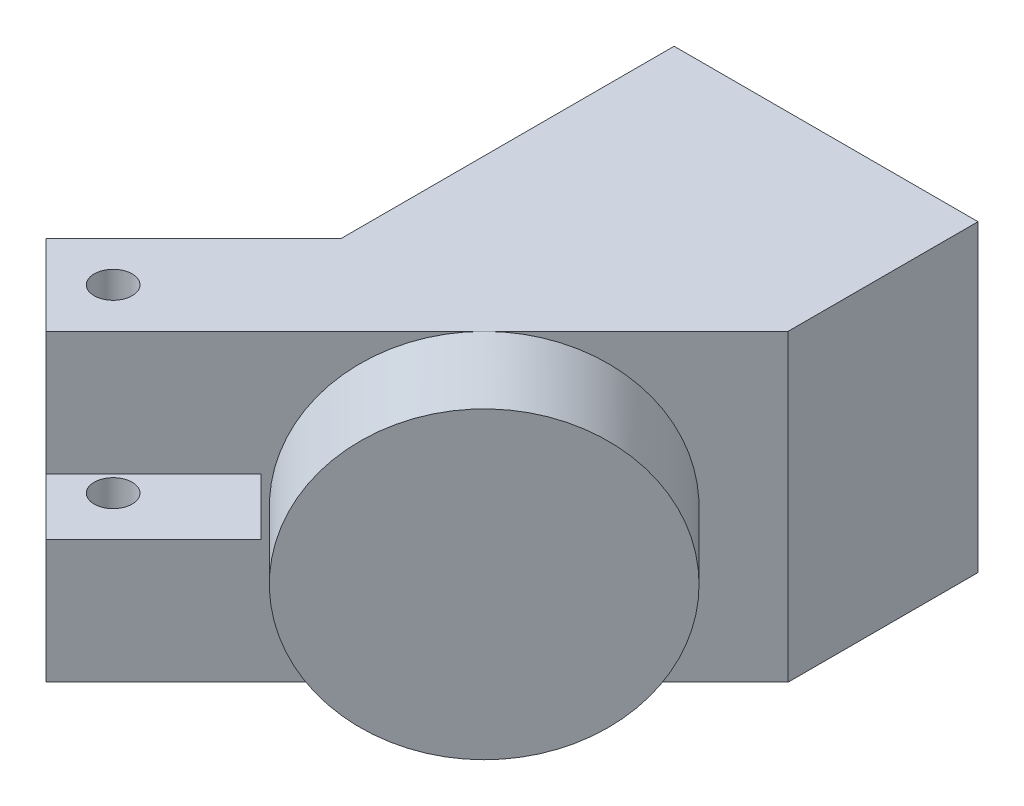
from build123d import *

# Parameters (mm, degrees)
SKETCH_1_W          = 16
SKETCH_1_H          = 16
SKETCH_1_W_2        = 10
SKETCH_1_H_2        = 10
EXTRUDE_1_DEPTH     = 10
EXTRUDE_2_DEPTH     = 16
EXTRUDE_3_DEPTH     = 5
EXTRUDE_5_DEPTH     = 16
SKETCH_12_W         = 6
SKETCH_12_H         = 3
CUT_EXTRUDE_2_DEPTH = 8
CUT_EXTRUDE_3_DEPTH = 16


with BuildPart() as part:
    # 草图1 → 凸台-拉伸1 (new body)
    with BuildSketch(Plane.XY):
        with Locations((8, 8)):
            Rectangle(SKETCH_1_W, SKETCH_1_H)
        with Locations((8, 8)):
            Rectangle(SKETCH_1_W_2, SKETCH_1_H_2, mode=Mode.SUBTRACT)
    extrude(amount=EXTRUDE_1_DEPTH)

    # 草图2 → 凸台-拉伸2 (add)
    with BuildSketch(Plane.XZ):
        Polygon((0, 10), (0, 26), (16, 10), align=None)
    extrude(amount=-EXTRUDE_2_DEPTH)

    # 草图6 → 凸台-拉伸3 (add)
    with BuildSketch(Plane(origin=(13, 0, 13), x_dir=(0.7071067811865475, 0, -0.7071067811865477), z_dir=(0.7071067811865477, 0, 0.7071067811865475))):
        with BuildLine():
            ThreePointArc((-7.071067812, 16), (-15.071067812, 8), (-7.071067812, 0))
            Line((-7.071067812, 0), (-7.071067812, 16))
        make_face()
        with BuildLine():
            Line((-7.071067812, 16), (-7.071067812, 0))
            ThreePointArc((-7.071067812, 0), (-1.414213562, 2.343145751), (0.928932188, 8))
            ThreePointArc((0.928932188, 8), (-1.414213562, 13.656854249), (-7.071067812, 16))
        make_face()
    extrude(amount=EXTRUDE_3_DEPTH)

    # 草图10 → 凸台-拉伸5 (add)
    with BuildSketch(Plane(origin=(0, 16, 0), x_dir=(1, 0, 0), z_dir=(0, 1, 0))):
        Polygon((0, -26), (-3.535533906, -29.535533906), (-7.778174593, -25.292893219), (0, -17.514718626), align=None)
    extrude(amount=-EXTRUDE_5_DEPTH)

    # 草图12 → 切除-拉伸2 (cut)
    with BuildSketch(Plane(origin=(-16.535533906, 0, 16.535533906), x_dir=(0.7071067811865475, 0, 0.7071067811865477), z_dir=(-0.7071067811865477, 0, 0.7071067811865475))):
        with Locations((15.384776311, 8)):
            Rectangle(SKETCH_12_W, SKETCH_12_H)
    extrude(amount=-CUT_EXTRUDE_2_DEPTH, mode=Mode.SUBTRACT)

    # 草图13 → 切除-拉伸3 (cut)
    with BuildSketch(Plane(origin=(0, 16, 0), x_dir=(1, 0, 0), z_dir=(0, 1, 0))):
        with BuildLine():
            ThreePointArc((-4.596194078, -24.939339828), (-4.596194078, -26.353553391), (-3.181980515, -26.353553391))
            Line((-3.181980515, -26.353553391), (-4.596194078, -24.939339828))
        make_face()
        with BuildLine():
            Line((-4.596194078, -24.939339828), (-3.181980515, -26.353553391))
            ThreePointArc((-3.181980515, -26.353553391), (-2.965207764, -26.029130042), (-2.889087297, -25.646446609))
            ThreePointArc((-2.889087297, -25.646446609), (-3.506403864, -24.722567077), (-4.596194078, -24.939339828))
        make_face()
    extrude(amount=-CUT_EXTRUDE_3_DEPTH, mode=Mode.SUBTRACT)


solid = part.part
